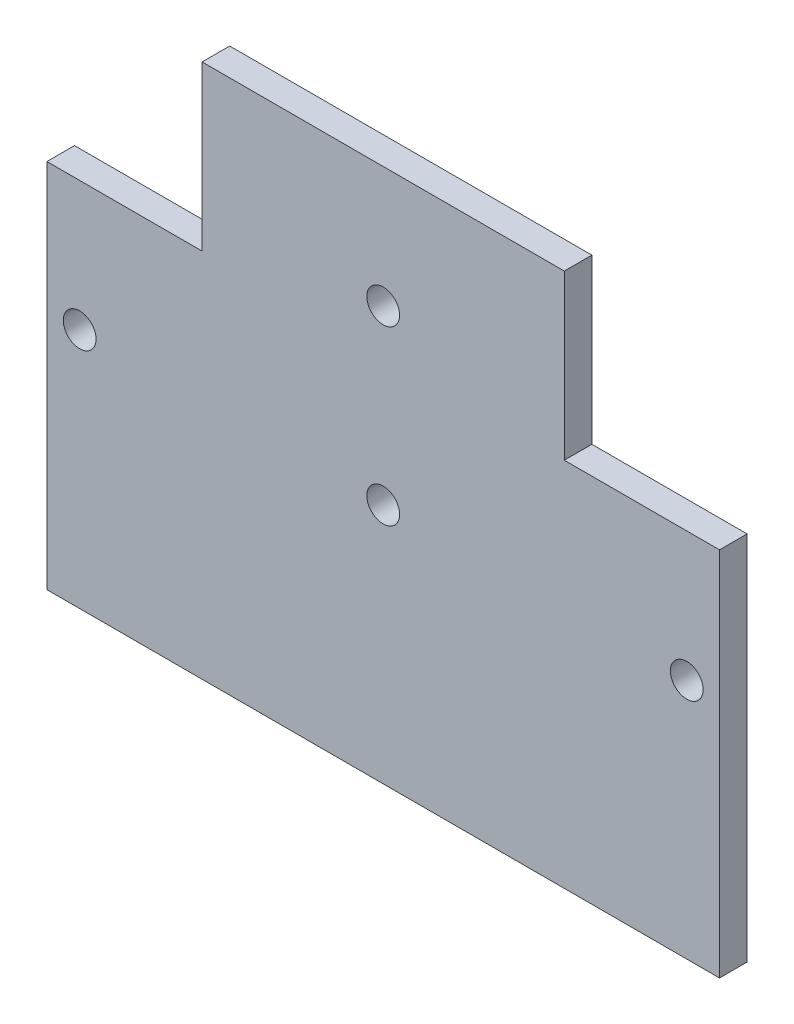
from build123d import *

# Parameters (mm, degrees)
SKETCH_1_R      = 0.95
EXTRUDE_1_DEPTH = 1.6


with BuildPart() as part:
    # 草图1 → 凸台-拉伸1 (new body)
    with BuildSketch(Plane.XY):
        Polygon((-19.5, 6), (-10.500000736, 6), (-10.500000736, 15.5), (10.5, 15.5), (10.5, 6), (19.5, 6), (19.5, -15.5), (-19.5, -15.5), align=None)
        with Locations((-17.6, -1.5)):
            Circle(SKETCH_1_R, mode=Mode.SUBTRACT)
        with Locations((0, -1.5)):
            Circle(SKETCH_1_R, mode=Mode.SUBTRACT)
        with Locations((17.6, -1.5)):
            Circle(SKETCH_1_R, mode=Mode.SUBTRACT)
        with Locations((0, 8.5)):
            Circle(SKETCH_1_R, mode=Mode.SUBTRACT)
    extrude(amount=EXTRUDE_1_DEPTH)


solid = part.part
